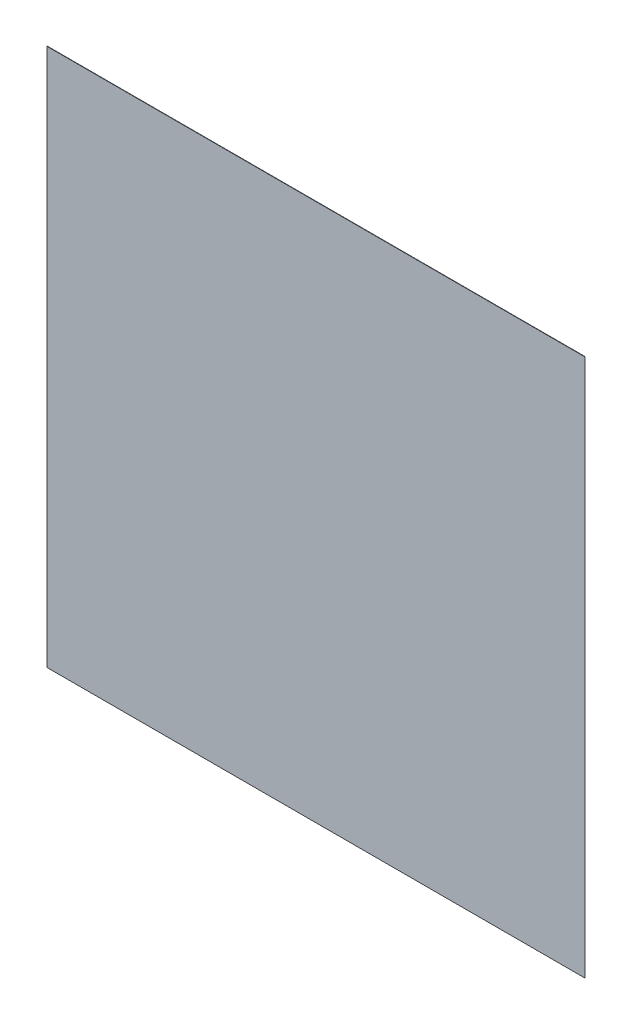
from build123d import *

# Parameters (mm, degrees)
SKETCH2_W           = 30
SKETCH2_H           = 30
BOSS_EXTRUDE1_DEPTH = 0.02


with BuildPart() as part:
    # Sketch2 → Boss-Extrude1 (new body)
    with BuildSketch(Plane.XY):
        Rectangle(SKETCH2_W, SKETCH2_H)
    extrude(amount=BOSS_EXTRUDE1_DEPTH)


solid = part.part
